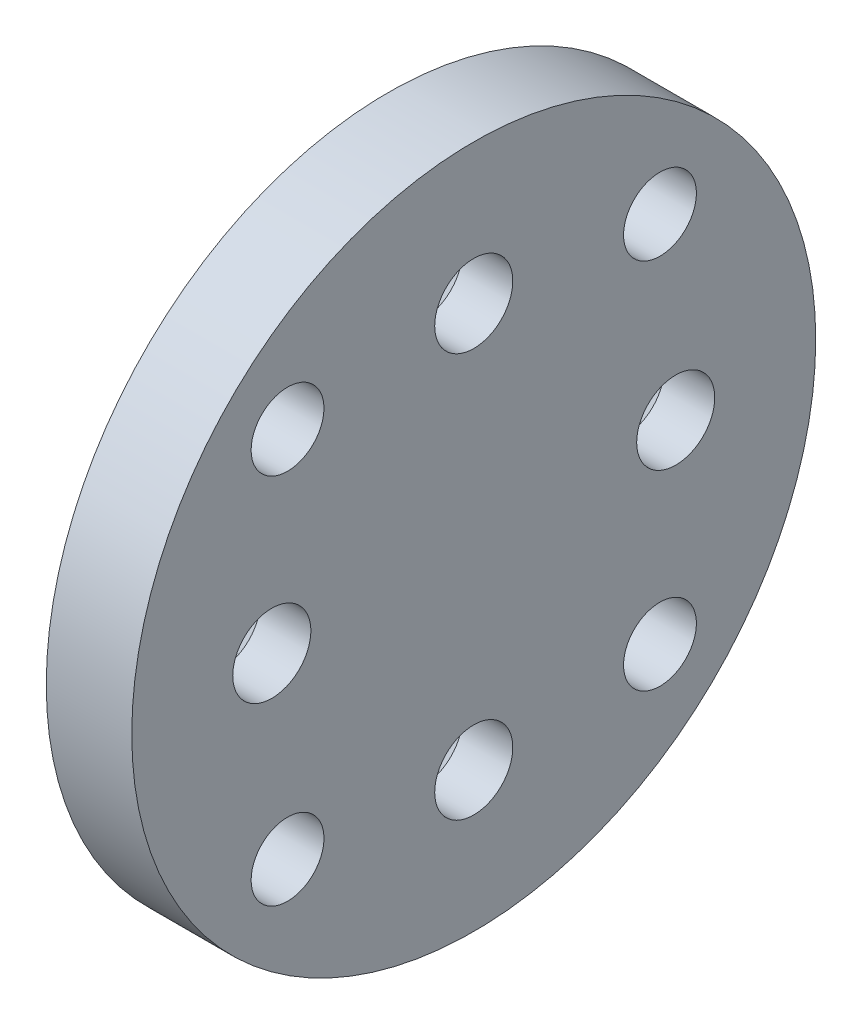
from build123d import *

# Parameters (mm, degrees)
SKETCH1_R                                         = 12.7
BOSS_EXTRUDE1_DEPTH                               = 3.175
CSK_FOR_M2_5_FLAT_HEAD_MACHINE_SCREW1_D           = 2.9
CSK_FOR_M2_5_FLAT_HEAD_MACHINE_SCREW1_CSINK_D     = 5.5
CSK_FOR_M2_5_FLAT_HEAD_MACHINE_SCREW1_CSINK_ANGLE = 90
F_6_32_TAPPED_HOLE1_D                             = 2.7051


with BuildPart() as part:
    # Sketch1 → Boss-Extrude1 (new body)
    with BuildSketch(Plane(origin=(0, 0, 0), x_dir=(0, 0, -1), z_dir=(1, 0, 0))):
        Circle(SKETCH1_R)
    extrude(amount=BOSS_EXTRUDE1_DEPTH)

    # CSK for M2.5 Flat Head Machine Screw1 (through all)
    with Locations(Plane.ZY):
        with Locations((0, 7.5), (0, -7.5), (7.5, 0), (-7.5, 0)):
            CounterSinkHole(CSK_FOR_M2_5_FLAT_HEAD_MACHINE_SCREW1_D / 2, CSK_FOR_M2_5_FLAT_HEAD_MACHINE_SCREW1_CSINK_D / 2, counter_sink_angle=CSK_FOR_M2_5_FLAT_HEAD_MACHINE_SCREW1_CSINK_ANGLE)

    # #6-32 Tapped Hole1 (through all)
    with Locations(Plane.ZY):
        with Locations((-6.914797213, 6.914797213), (-6.914797213, -6.914797213), (6.914797213, 6.914797213), (6.914797213, -6.914797213)):
            Hole(F_6_32_TAPPED_HOLE1_D / 2)


solid = part.part
